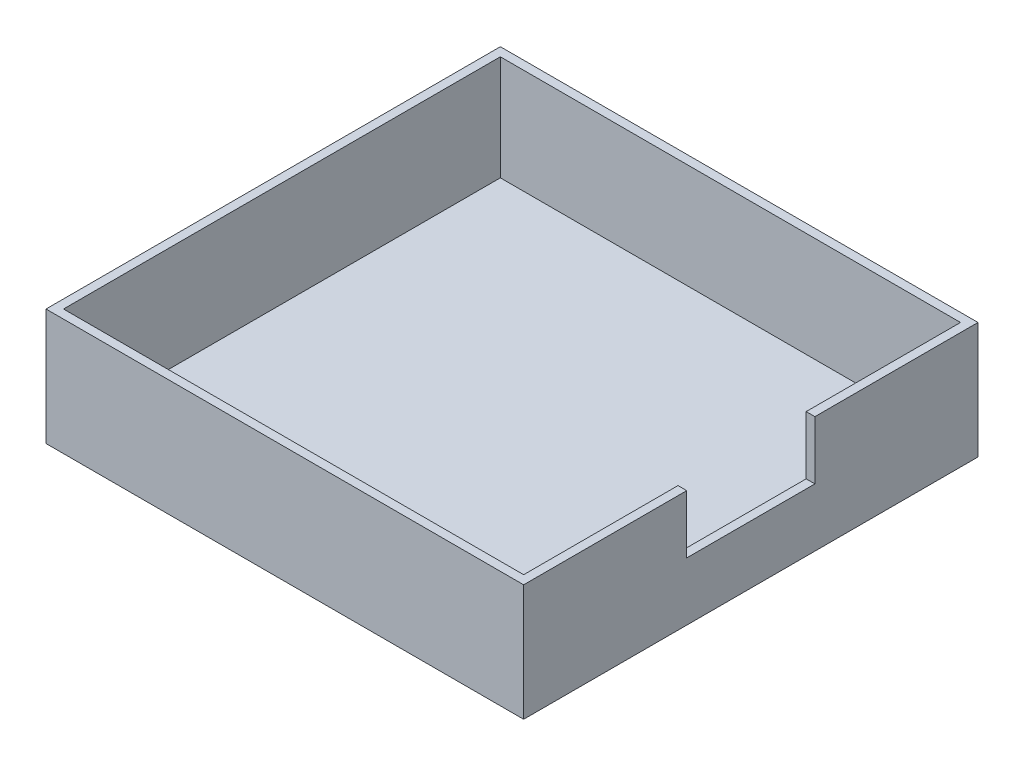
from build123d import *

# Parameters (mm, degrees)
CROQUIS1_W              = 79
CROQUIS1_H              = 75
SALIENTE_EXTRUIR1_DEPTH = 2
SALIENTE_EXTRUIR3_DEPTH = 20
CROQUIS1_5_W            = 1.5
CROQUIS1_5_H            = 22
SALIENTE_EXTRUIR4_DEPTH = 10


with BuildPart() as part:
    # Croquis1 → Saliente-Extruir1 (new body)
    with BuildSketch(Plane(origin=(0, 0, 0), x_dir=(1, 0, 0), z_dir=(0, 1, 0))):
        Rectangle(CROQUIS1_W, CROQUIS1_H)
    extrude(amount=SALIENTE_EXTRUIR1_DEPTH)

    # Croquis1<4> → Saliente-Extruir3 (add)
    with BuildSketch(Plane(origin=(0, 0, 0), x_dir=(1, 0, 0), z_dir=(0, 1, 0))):
        Polygon((-39.5, -37.5), (-39.5, 37.5), (39.5, 37.5), (39.5, 11), (41, 11), (41, 39), (-41, 39), (-41, -39), (41, -39), (41, -11), (39.5, -11), (39.5, -37.5), align=None)
    extrude(amount=SALIENTE_EXTRUIR3_DEPTH)

    # Croquis1<5> → Saliente-Extruir4 (add)
    with BuildSketch(Plane(origin=(0, 0, 0), x_dir=(1, 0, 0), z_dir=(0, 1, 0))):
        with Locations((40.25, 0)):
            Rectangle(CROQUIS1_5_W, CROQUIS1_5_H)
    extrude(amount=SALIENTE_EXTRUIR4_DEPTH)


solid = part.part
